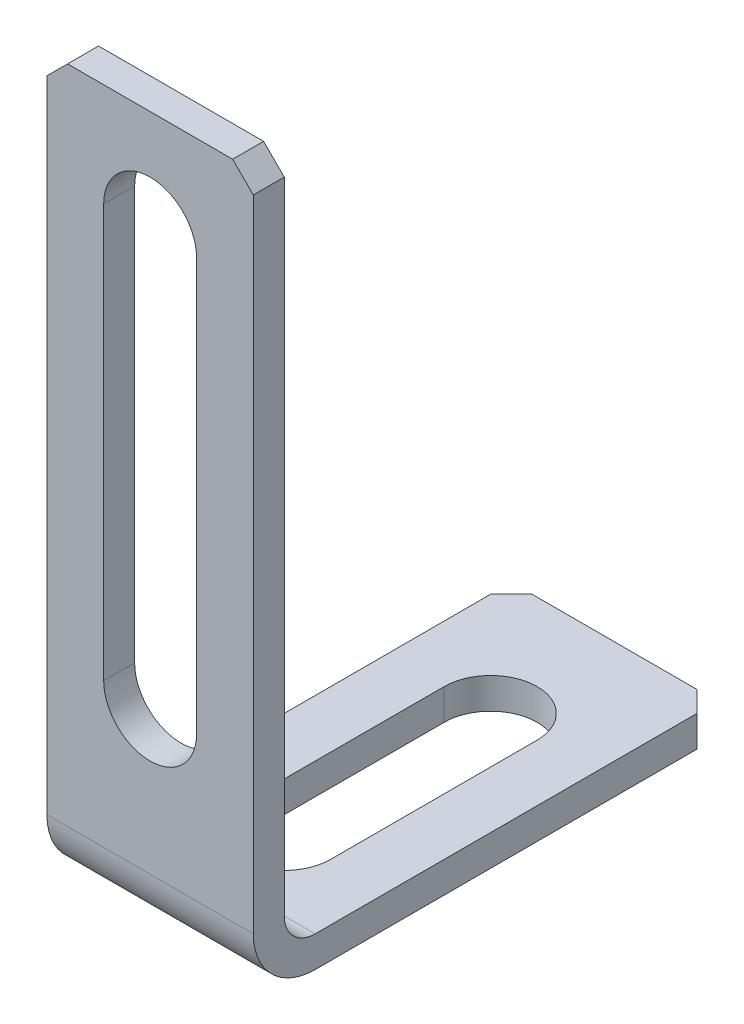
from build123d import *

# Parameters (mm, degrees)
SKETCH1_W           = 45
SKETCH1_H           = 70
BOSS_EXTRUDE1_DEPTH = 20
SKETCH2_W           = 42
SKETCH2_H           = 67
CUT_EXTRUDE1_DEPTH  = 86.586213843
CUT_EXTRUDE2_DEPTH  = 84.150466024
CUT_EXTRUDE3_DEPTH  = 85.047605558
CHAMFER1_SIZE       = 2
FILLET1_R           = 3
FILLET2_R           = 6


with BuildPart() as part:
    # Sketch1 → Boss-Extrude1 (new body)
    with BuildSketch(Plane(origin=(20, 0, 0), x_dir=(0, 0, -1), z_dir=(1, 0, 0))):
        with Locations((22.5, 35)):
            Rectangle(SKETCH1_W, SKETCH1_H)
    extrude(amount=-BOSS_EXTRUDE1_DEPTH)

    # Sketch2 → Cut-Extrude1 (cut, through all)
    with BuildSketch(Plane.ZY):
        with Locations((-24, 36.5)):
            Rectangle(SKETCH2_W, SKETCH2_H)
    extrude(amount=-CUT_EXTRUDE1_DEPTH, mode=Mode.SUBTRACT)

    # Sketch3 → Cut-Extrude2 (cut, through all)
    with BuildSketch(Plane(origin=(0, 3, 0), x_dir=(-1, 0, 0), z_dir=(0, 1, 0))):
        with BuildLine():
            Line((-5.5, -33), (-5.5, -13))
            ThreePointArc((-5.5, -13), (-10, -8.5), (-14.5, -13))
            Line((-14.5, -13), (-14.5, -33))
            ThreePointArc((-14.5, -33), (-10, -37.5), (-5.5, -33))
        make_face()
    extrude(amount=-CUT_EXTRUDE2_DEPTH, mode=Mode.SUBTRACT)

    # Sketch4 → Cut-Extrude3 (cut, through all)
    with BuildSketch(Plane(origin=(0, 0, -3), x_dir=(-1, 0, 0), z_dir=(0, 0, -1))):
        with BuildLine():
            Line((-14.5, 60), (-14.5, 20))
            ThreePointArc((-14.5, 20), (-10, 15.5), (-5.5, 20))
            Line((-5.5, 20), (-5.5, 60))
            ThreePointArc((-5.5, 60), (-10, 64.5), (-14.5, 60))
        make_face()
    extrude(amount=-CUT_EXTRUDE3_DEPTH, mode=Mode.SUBTRACT)

    # Chamfer1
    chamfer1_edges = [part.edges().sort_by_distance(p)[0] for p in [
        (0, 1.5, -45),
        (20, 70, -1.5),
        (0, 70, -1.5),
        (20, 1.5, -45),
    ]]
    chamfer(chamfer1_edges, length=CHAMFER1_SIZE)

    # Fillet1
    fillet1_edges = [part.edges().sort_by_distance(p)[0] for p in [
        (10, 3, -3),
    ]]
    fillet(fillet1_edges, radius=FILLET1_R)

    # Fillet2
    fillet2_edges = [part.edges().sort_by_distance(p)[0] for p in [
        (10, 0, 0),
    ]]
    fillet(fillet2_edges, radius=FILLET2_R)


solid = part.part
